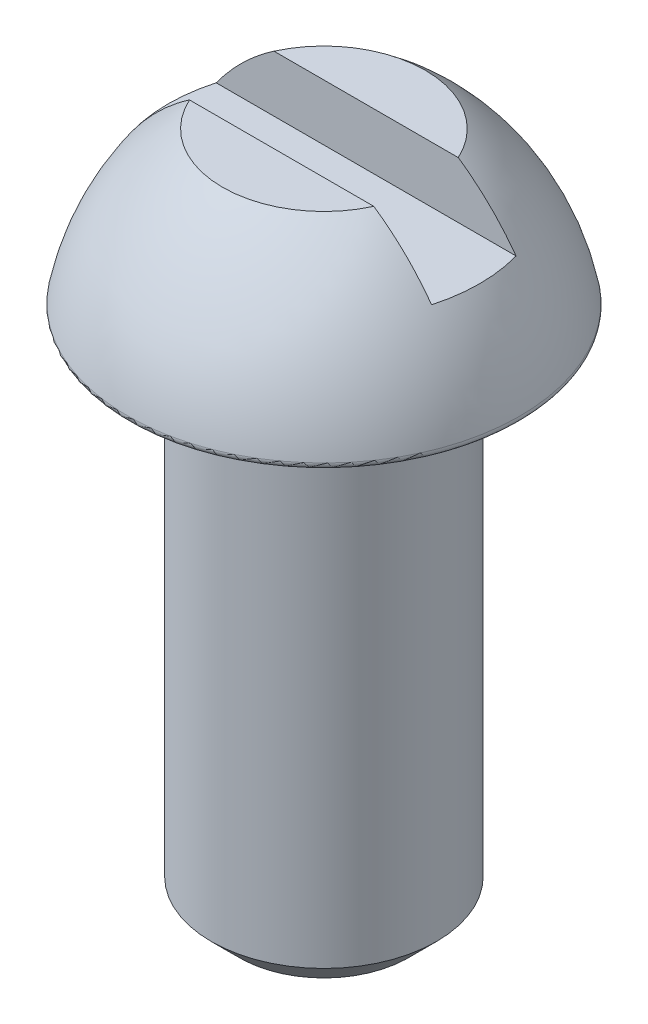
from build123d import *

# Parameters (mm, degrees)
FILLET_1_R          = 0.1
SKETCH_3_W          = 8
SKETCH_3_H          = 1.5
CUT_EXTRUDE_2_DEPTH = 1


with BuildPart() as part:
    # Эскиз1 → Повернуть1 (revolve)
    with BuildSketch(Plane.XY):
        with BuildLine():
            Line((3.5, 9.2), (2, 9.2))
            Line((2, 9.2), (2, 0.5))
            Line((2, 0.5), (1.5, 0))
            Line((1.5, 0), (0, 0))
            Line((0, 0), (0, 12))
            Line((0, 12), (1.8, 12))
            ThreePointArc((1.8, 12), (2.920275695, 10.764095958), (3.5, 9.2))
        make_face()
    revolve(axis=Axis((0, 0, 0), (0, 1, 0)))

    # Скругление1
    fillet_1_edges = [part.edges().sort_by_distance(p)[0] for p in [
        (-3.5, 9.2, 0),
    ]]
    fillet(fillet_1_edges, radius=FILLET_1_R)

    # Эскиз3 → Вырез-Вытянуть2 (cut)
    with BuildSketch(Plane(origin=(0, 12, 0), x_dir=(-1, 0, 0), z_dir=(0, 1, 0))):
        Rectangle(SKETCH_3_W, SKETCH_3_H)
    extrude(amount=-CUT_EXTRUDE_2_DEPTH, mode=Mode.SUBTRACT)


solid = part.part
